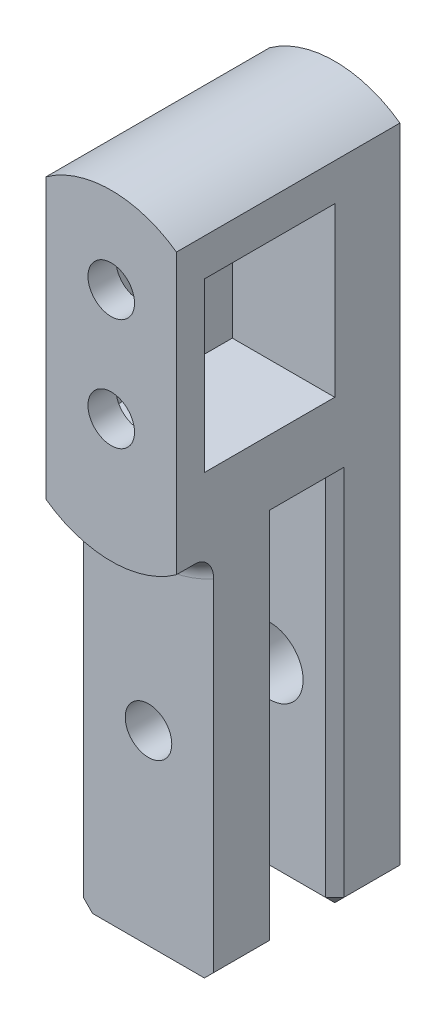
from build123d import *

# Parameters (mm, degrees)
SKETCH1_W           = 7
SKETCH1_H           = 35
BOSS_EXTRUDE1_DEPTH = 3.5
SKETCH2_W           = 7
SKETCH2_H           = 15
BOSS_EXTRUDE2_DEPTH = 3
SKETCH3_W           = 7
SKETCH3_H           = 35
BOSS_EXTRUDE3_DEPTH = 3.5
SKETCH4_W           = 7
SKETCH4_H           = 15
BOSS_EXTRUDE4_DEPTH = 2
CUT_EXTRUDE1_START  = -1.5
SKETCH5_W           = 7
SKETCH5_H           = 9
CUT_EXTRUDE1_DEPTH  = 5.5
CUT_EXTRUDE2_REACH  = 39.407
SKETCH6_R           = 0.75
CUT_EXTRUDE3_REACH  = 39.656
SKETCH7_R           = 1.25
BOSS_EXTRUDE5_DEPTH = 12
BOSS_EXTRUDE6_DEPTH = 2
CHAMFER1_SIZE       = 0.5
CUT_EXTRUDE4_REACH  = 39.068
SKETCH11_R          = 1.25
CUT_EXTRUDE5_REACH  = 39.656
SKETCH12_R          = 1.8
FILLET1_R           = 1


with BuildPart() as part:
    # Sketch1 → Boss-Extrude1 (new body)
    with BuildSketch(Plane.XY):
        with Locations((3.5, -17.5)):
            Rectangle(SKETCH1_W, SKETCH1_H)
    extrude(amount=BOSS_EXTRUDE1_DEPTH)

    # Sketch2 → Boss-Extrude2 (add)
    with BuildSketch(Plane.XY.offset(3.5)):
        with Locations((3.5, -7.5)):
            Rectangle(SKETCH2_W, SKETCH2_H)
    extrude(amount=BOSS_EXTRUDE2_DEPTH)

    # Sketch3 → Boss-Extrude3 (add)
    with BuildSketch(Plane.XY.offset(6.5)):
        with Locations((3.5, -17.5)):
            Rectangle(SKETCH3_W, SKETCH3_H)
    extrude(amount=BOSS_EXTRUDE3_DEPTH)

    # Sketch4 → Boss-Extrude4 (add)
    with BuildSketch(Plane.XY.offset(10)):
        with Locations((3.5, -7.5)):
            Rectangle(SKETCH4_W, SKETCH4_H)
    extrude(amount=BOSS_EXTRUDE4_DEPTH)

    # Sketch5 → Cut-Extrude1 (cut)
    with BuildSketch(Plane.ZY.offset(CUT_EXTRUDE1_START)):
        with Locations((7, -6.5)):
            Rectangle(SKETCH5_W, SKETCH5_H)
    extrude(amount=-CUT_EXTRUDE1_DEPTH, mode=Mode.SUBTRACT)

    # Sketch6 → Cut-Extrude2 (cut, up to next)
    with BuildSketch(Plane.ZY.offset(-5.5), mode=Mode.PRIVATE) as cut_extrude2_sk1:
        with Locations(Location((6.5, -3.5, 0), (0, 0, 180))):
            Circle(SKETCH6_R)
    cut_extrude2_tool1 = extrude(cut_extrude2_sk1.sketch, amount=CUT_EXTRUDE2_REACH, mode=Mode.PRIVATE) & part.part
    # Sketch6 → Cut-Extrude2 (cut, up to next)
    with BuildSketch(Plane.ZY.offset(-5.5), mode=Mode.PRIVATE) as cut_extrude2_sk2:
        with Locations(Location((6.5, -9.5, 0), (0, 0, 180))):
            Circle(SKETCH6_R)
    cut_extrude2_tool2 = extrude(cut_extrude2_sk2.sketch, amount=CUT_EXTRUDE2_REACH, mode=Mode.PRIVATE) & part.part
    # Sketch6 → Cut-Extrude2 (cut, up to next)
    with BuildSketch(Plane.ZY.offset(-5.5), mode=Mode.PRIVATE) as cut_extrude2_sk3:
        with Locations(Location((6.5, -6.5, 0), (0, 0, 180))):
            Circle(SKETCH6_R)
    cut_extrude2_tool3 = extrude(cut_extrude2_sk3.sketch, amount=CUT_EXTRUDE2_REACH, mode=Mode.PRIVATE) & part.part
    add(cut_extrude2_tool1.solids().sort_by_distance((5.5, -3.5, 6.5))[0], mode=Mode.SUBTRACT)
    add(cut_extrude2_tool2.solids().sort_by_distance((5.5, -9.5, 6.5))[0], mode=Mode.SUBTRACT)
    add(cut_extrude2_tool3.solids().sort_by_distance((5.5, -6.5, 6.5))[0], mode=Mode.SUBTRACT)

    # Sketch7 → Cut-Extrude3 (cut, up to next)
    with BuildSketch(Plane.XY.offset(12), mode=Mode.PRIVATE) as cut_extrude3_sk1:
        with Locations((3.5, -3.5)):
            Circle(SKETCH7_R)
    cut_extrude3_tool1 = extrude(cut_extrude3_sk1.sketch, amount=-CUT_EXTRUDE3_REACH, mode=Mode.PRIVATE) & part.part
    # Sketch7 → Cut-Extrude3 (cut, up to next)
    with BuildSketch(Plane.XY.offset(12), mode=Mode.PRIVATE) as cut_extrude3_sk2:
        with Locations((3.5, -9.5)):
            Circle(SKETCH7_R)
    cut_extrude3_tool2 = extrude(cut_extrude3_sk2.sketch, amount=-CUT_EXTRUDE3_REACH, mode=Mode.PRIVATE) & part.part
    add(cut_extrude3_tool1.solids().sort_by_distance((3.5, -3.5, 12))[0], mode=Mode.SUBTRACT)
    add(cut_extrude3_tool2.solids().sort_by_distance((3.5, -9.5, 12))[0], mode=Mode.SUBTRACT)

    # Sketch9 → Boss-Extrude5 (add)
    with BuildSketch(Plane.XY.offset(12)):
        with BuildLine():
            Line((0, 0), (7, 0))
            ThreePointArc((7, 0), (3.5, 1.126602828), (0, 0))
        make_face()
    extrude(amount=-BOSS_EXTRUDE5_DEPTH)

    # Sketch10 → Boss-Extrude6 (add)
    with BuildSketch(Plane.XY.offset(12)):
        with BuildLine():
            Line((0, -15), (7, -15))
            ThreePointArc((7, -15), (3.5, -16.126602828), (0, -15))
        make_face()
    extrude(amount=-BOSS_EXTRUDE6_DEPTH)

    # Chamfer1
    chamfer1_edges = [part.edges().sort_by_distance(p)[0] for p in [
        (7, -25, 3.5),
        (0, -25, 3.5),
        (0, -15, 5),
        (7, -15, 5),
        (0, -25, 6.5),
        (3.5, -35, 6.5),
        (0, -35, 8.25),
        (7, -25, 6.5),
        (7, -35, 8.25),
        (7, -35, 1.75),
        (0, -35, 1.75),
        (3.5, -35, 3.5),
    ]]
    chamfer(chamfer1_edges, length=CHAMFER1_SIZE)

    # Sketch11 → Cut-Extrude4 (cut, up to next)
    with BuildSketch(Plane.XY.offset(10), mode=Mode.PRIVATE) as cut_extrude4_sk1:
        with Locations((3.5, -25)):
            Circle(SKETCH11_R)
    cut_extrude4_tool1 = extrude(cut_extrude4_sk1.sketch, amount=-CUT_EXTRUDE4_REACH, mode=Mode.PRIVATE) & part.part
    add(cut_extrude4_tool1.solids().sort_by_distance((3.5, -25, 10))[0], mode=Mode.SUBTRACT)

    # Sketch12 → Cut-Extrude5 (cut, up to next)
    with BuildSketch(Plane(origin=(0, 0, 0), x_dir=(-1, 0, 0), z_dir=(0, 0, -1)), mode=Mode.PRIVATE) as cut_extrude5_sk1:
        with Locations((-3.5, -25)):
            Circle(SKETCH12_R)
    cut_extrude5_tool1 = extrude(cut_extrude5_sk1.sketch, amount=-CUT_EXTRUDE5_REACH, mode=Mode.PRIVATE) & part.part
    add(cut_extrude5_tool1.solids().sort_by_distance((3.5, -25, 0))[0], mode=Mode.SUBTRACT)

    # Fillet1
    fillet1_edges = [part.edges().sort_by_distance(p)[0] for p in [
        (3.5, -16.126602828, 10),
    ]]
    fillet(fillet1_edges, radius=FILLET1_R)


solid = part.part
